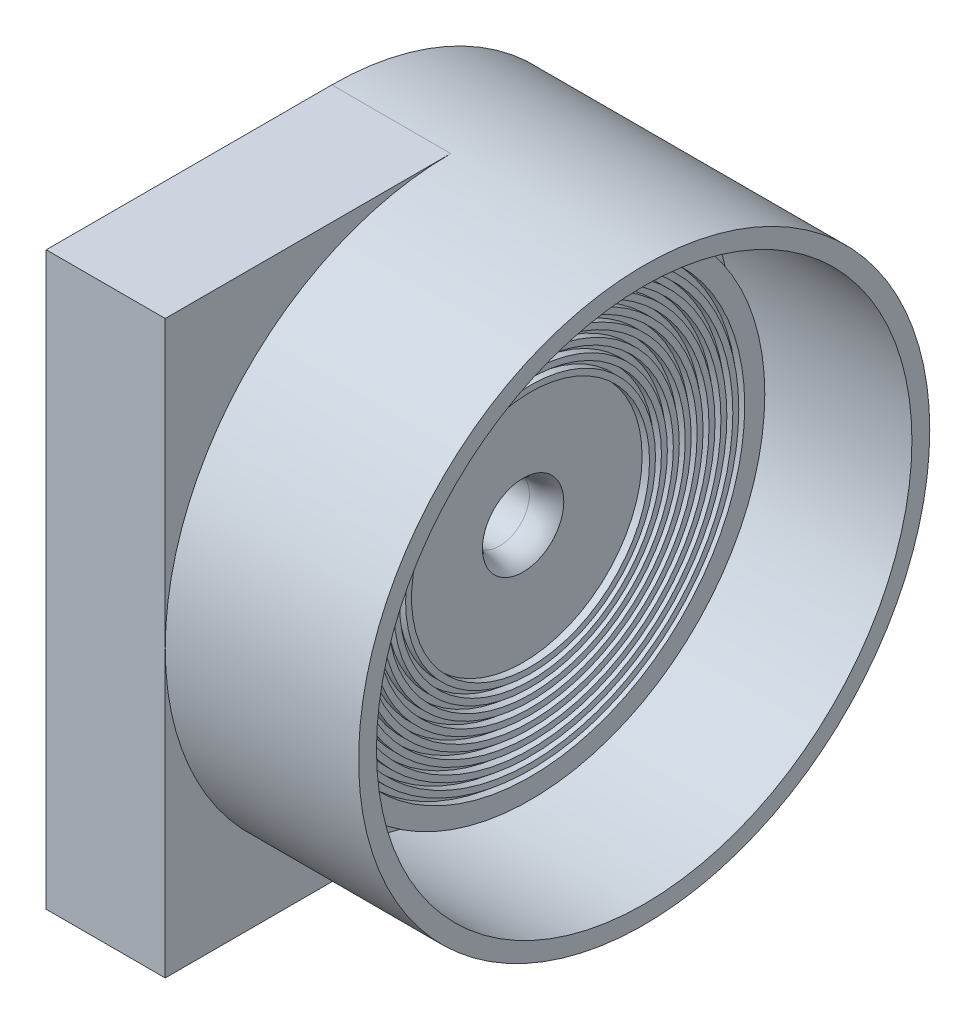
from build123d import *

# Parameters (mm, degrees)
SKETCH1_R                     = 43.815
HOUSING_FITTING_EXTRUDE_DEPTH = 17.018
HOUSING_BODY_1_DEPTH          = 25.4
SKETCH3_R                     = 6.3754
IMPELLER_BORE_DEPTH           = 17.018
O_RING_CUT_DEPTH              = 1.27
O_RING_CUT_DEPTH_BACK         = 1.27
SKETCH5_R                     = 43.942
SKETCH5_R_2                   = 43.18
SKETCH14_R                    = 3.3734375
CUT_EXTRUDE4_DEPTH            = 19.05
SKETCH15_R                    = 3.3734375
CUT_EXTRUDE5_DEPTH            = 19.05
FILLET1_R                     = 6.604
SKETCH20_R                    = 60.96
SKETCH20_R_2                  = 43.815
BOSS_EXTRUDE1_DEPTH           = 3.175
SKETCH21_R                    = 60.96
SKETCH21_R_2                  = 57.15
BOSS_EXTRUDE2_DEPTH           = 38.1
SKETCH23_R                    = 50.00625
SKETCH23_R_2                  = 43.815
BOSS_EXTRUDE3_DEPTH           = 13.843
SKETCH25_R                    = 3.3734375
CUT_EXTRUDE13_DEPTH           = 25.4
SKETCH26_R                    = 12.954
CUT_EXTRUDE14_DEPTH           = 25.908
SKETCH29_R                    = 45.72
SKETCH29_R_2                  = 44.45
SKETCH29_R_3                  = 43.18
SKETCH29_R_4                  = 41.91
SKETCH29_R_5                  = 40.64
SKETCH29_R_6                  = 39.37
SKETCH29_R_7                  = 38.1
SKETCH29_R_8                  = 36.83
SKETCH29_R_9                  = 35.56
SKETCH29_R_10                 = 34.29
SKETCH29_R_11                 = 33.02
SKETCH29_R_12                 = 31.75
SKETCH29_R_13                 = 30.48
SKETCH29_R_14                 = 29.21
SKETCH29_R_15                 = 27.94
SKETCH29_R_16                 = 26.67
SKETCH29_R_17                 = 25.4
CUT_EXTRUDE16_DEPTH           = 1.5875


with BuildPart() as part:
    # Sketch1 → Housing Fitting Extrude (new body)
    with BuildSketch(Plane(origin=(0, 0, 0), x_dir=(0, 0, -1), z_dir=(1, 0, 0))):
        Circle(SKETCH1_R)
    extrude(amount=HOUSING_FITTING_EXTRUDE_DEPTH)

    # Sketch2 → Housing Body 1 (add)
    with BuildSketch(Plane.ZY):
        with BuildLine():
            Line((60.96, 0), (60.96, 60.96))
            Line((60.96, 60.96), (0, 60.96))
            ThreePointArc((0, 60.96), (-43.105229381, 43.105229381), (-60.96, 0))
            Line((-60.96, 0), (-60.96, -54.61))
            Line((-60.96, -54.61), (-60.96, -60.96))
            Line((-60.96, -60.96), (60.96, -60.96))
            Line((60.96, -60.96), (60.96, -54.61))
            Line((60.96, -54.61), (60.96, 0))
        make_face()
    extrude(amount=HOUSING_BODY_1_DEPTH)

    # Sketch3 → Impeller Bore (cut)
    with BuildSketch(Plane(origin=(17.018, 0, 0), x_dir=(0, 0, -1), z_dir=(1, 0, 0))):
        Circle(SKETCH3_R)
    extrude(amount=-IMPELLER_BORE_DEPTH, mode=Mode.SUBTRACT)

    # Sketch5 → O-Ring Cut (cut, two sides: drawn at the far end of the back side and taken through both)
    with BuildSketch(Plane(origin=(8.509, 0, 0), x_dir=(0, 0, -1), z_dir=(1, 0, 0)).offset(-O_RING_CUT_DEPTH_BACK)):
        Circle(SKETCH5_R)
        Circle(SKETCH5_R_2, mode=Mode.SUBTRACT)
    extrude(amount=O_RING_CUT_DEPTH + O_RING_CUT_DEPTH_BACK, mode=Mode.SUBTRACT)

    # Sketch14 → Cut-Extrude4 (cut)
    with BuildSketch(Plane.XZ.offset(60.96)):
        with Locations(Location((-9.525, -41.91, 0), (0, 0, 270))):
            Circle(SKETCH14_R)
        with Locations(Location((-9.525, 41.91, 0), (0, 0, 270))):
            Circle(SKETCH14_R)
    extrude(amount=-CUT_EXTRUDE4_DEPTH, mode=Mode.SUBTRACT)

    # Sketch15 → Cut-Extrude5 (cut)
    with BuildSketch(Plane(origin=(0, 0, -60.96), x_dir=(-1, 0, 0), z_dir=(0, 0, -1))):
        with Locations(Location((9.525, -35.56, 0), (0, 0, 90))):
            Circle(SKETCH15_R)
    extrude(amount=-CUT_EXTRUDE5_DEPTH, mode=Mode.SUBTRACT)

    # Fillet1
    fillet1_edges = [part.edges().sort_by_distance(p)[0] for p in [
        (17.018, 0, 6.3754),
    ]]
    fillet(fillet1_edges, radius=FILLET1_R)

    # Sketch20 → Boss-Extrude1 (add)
    with BuildSketch(Plane(origin=(0, 0, 0), x_dir=(0, 0, -1), z_dir=(1, 0, 0))):
        Circle(SKETCH20_R)
        Circle(SKETCH20_R_2, mode=Mode.SUBTRACT)
    extrude(amount=BOSS_EXTRUDE1_DEPTH)

    # Sketch21 → Boss-Extrude2 (add)
    with BuildSketch(Plane(origin=(3.175, 0, 0), x_dir=(0, 0, -1), z_dir=(1, 0, 0))):
        Circle(SKETCH21_R)
        with Locations(Location((0, 0, 0), (0, 0, 180))):
            Circle(SKETCH21_R_2, mode=Mode.SUBTRACT)
    extrude(amount=BOSS_EXTRUDE2_DEPTH)

    # Sketch23 → Boss-Extrude3 (add)
    with BuildSketch(Plane(origin=(3.175, 0, 0), x_dir=(0, 0, -1), z_dir=(1, 0, 0))):
        Circle(SKETCH23_R)
        Circle(SKETCH23_R_2, mode=Mode.SUBTRACT)
    extrude(amount=BOSS_EXTRUDE3_DEPTH)

    # Sketch25 → Cut-Extrude13 (cut)
    with BuildSketch(Plane.ZY.offset(25.4)):
        with Locations((37.777249767, 4.948676591)):
            Circle(SKETCH25_R)
        with Locations((30.211792261, -23.21330671)):
            Circle(SKETCH25_R)
        with Locations((4.948676591, -37.777249767)):
            Circle(SKETCH25_R)
        with Locations((-23.21330671, -30.211792261)):
            Circle(SKETCH25_R)
        with Locations((-37.777249767, -4.948676591)):
            Circle(SKETCH25_R)
        with Locations((-30.211792261, 23.21330671)):
            Circle(SKETCH25_R)
        with Locations((-4.948676591, 37.777249767)):
            Circle(SKETCH25_R)
        with Locations((23.21330671, 30.211792261)):
            Circle(SKETCH25_R)
    extrude(amount=-CUT_EXTRUDE13_DEPTH, mode=Mode.SUBTRACT)

    # Sketch26 → Cut-Extrude14 (cut)
    with BuildSketch(Plane.ZY.offset(25.4)):
        Circle(SKETCH26_R)
    extrude(amount=-CUT_EXTRUDE14_DEPTH, mode=Mode.SUBTRACT)

    # Sketch29 → Cut-Extrude16 (cut)
    # profile 1 of 9: a face of its own
    with BuildSketch(Plane(origin=(17.018, 0, 0), x_dir=(0, 0, -1), z_dir=(1, 0, 0))):
        Circle(SKETCH29_R)
        Circle(SKETCH29_R_2, mode=Mode.SUBTRACT)
    # profile 2 of 9: a face of its own
    with BuildSketch(Plane(origin=(17.018, 0, 0), x_dir=(0, 0, -1), z_dir=(1, 0, 0))):
        Circle(SKETCH29_R_3)
        Circle(SKETCH29_R_4, mode=Mode.SUBTRACT)
    # profile 3 of 9: a face of its own
    with BuildSketch(Plane(origin=(17.018, 0, 0), x_dir=(0, 0, -1), z_dir=(1, 0, 0))):
        Circle(SKETCH29_R_5)
        Circle(SKETCH29_R_6, mode=Mode.SUBTRACT)
    # profile 4 of 9: a face of its own
    with BuildSketch(Plane(origin=(17.018, 0, 0), x_dir=(0, 0, -1), z_dir=(1, 0, 0))):
        Circle(SKETCH29_R_7)
        Circle(SKETCH29_R_8, mode=Mode.SUBTRACT)
    # profile 5 of 9: a face of its own
    with BuildSketch(Plane(origin=(17.018, 0, 0), x_dir=(0, 0, -1), z_dir=(1, 0, 0))):
        Circle(SKETCH29_R_9)
        Circle(SKETCH29_R_10, mode=Mode.SUBTRACT)
    # profile 6 of 9: a face of its own
    with BuildSketch(Plane(origin=(17.018, 0, 0), x_dir=(0, 0, -1), z_dir=(1, 0, 0))):
        Circle(SKETCH29_R_11)
        Circle(SKETCH29_R_12, mode=Mode.SUBTRACT)
    # profile 7 of 9: a face of its own
    with BuildSketch(Plane(origin=(17.018, 0, 0), x_dir=(0, 0, -1), z_dir=(1, 0, 0))):
        Circle(SKETCH29_R_13)
        Circle(SKETCH29_R_14, mode=Mode.SUBTRACT)
    # profile 8 of 9: a face of its own
    with BuildSketch(Plane(origin=(17.018, 0, 0), x_dir=(0, 0, -1), z_dir=(1, 0, 0))):
        Circle(SKETCH29_R_15)
        Circle(SKETCH29_R_16, mode=Mode.SUBTRACT)
    # profile 9 of 9: a face of its own
    with BuildSketch(Plane(origin=(17.018, 0, 0), x_dir=(0, 0, -1), z_dir=(1, 0, 0))):
        Circle(SKETCH29_R_17)
    extrude(amount=-CUT_EXTRUDE16_DEPTH, mode=Mode.SUBTRACT)


solid = part.part
